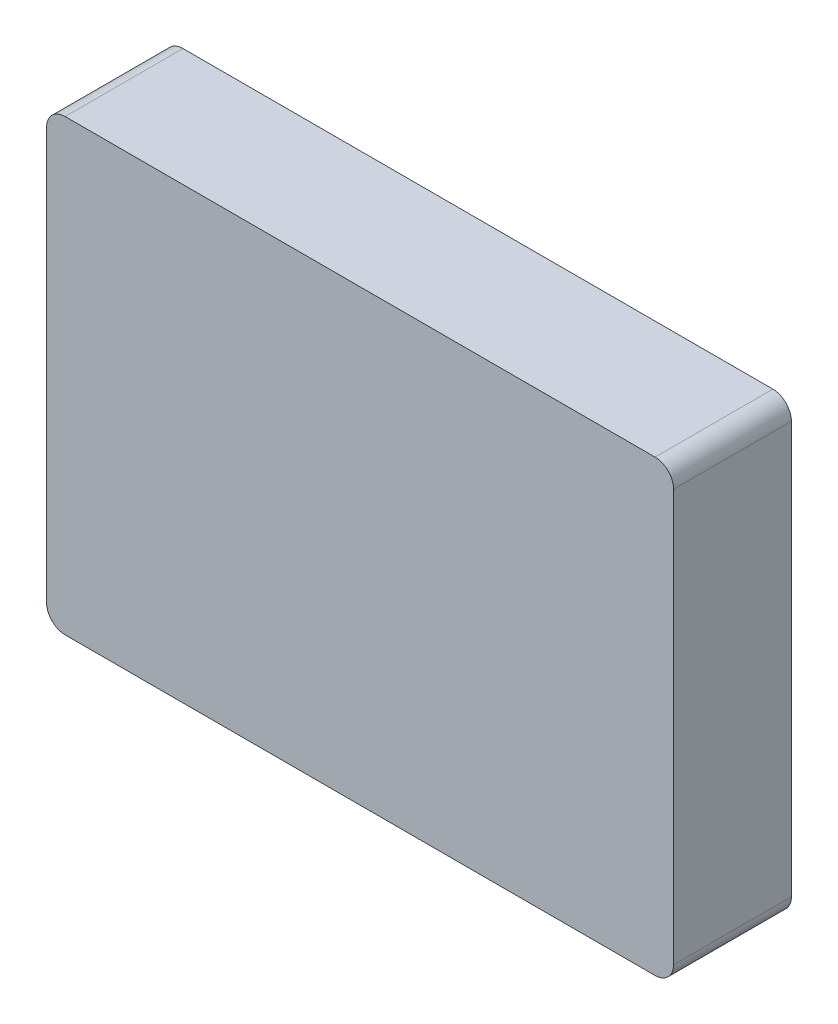
from build123d import *

# Parameters (mm, degrees)
SKETCH1_W           = 16.9
SKETCH1_H           = 12.1
BOSS_EXTRUDE1_DEPTH = 3.175
FILLET1_R           = 0.5


with BuildPart() as part:
    # Sketch1 → Boss-Extrude1 (new body)
    with BuildSketch(Plane.XY):
        Rectangle(SKETCH1_W, SKETCH1_H)
    extrude(amount=BOSS_EXTRUDE1_DEPTH)

    # Fillet1
    fillet1_edges = [part.edges().sort_by_distance(p)[0] for p in [
        (-8.45, 6.05, 1.5875),
        (8.45, 6.05, 1.5875),
        (8.45, -6.05, 1.5875),
        (-8.45, -6.05, 1.5875),
    ]]
    fillet(fillet1_edges, radius=FILLET1_R)


solid = part.part
